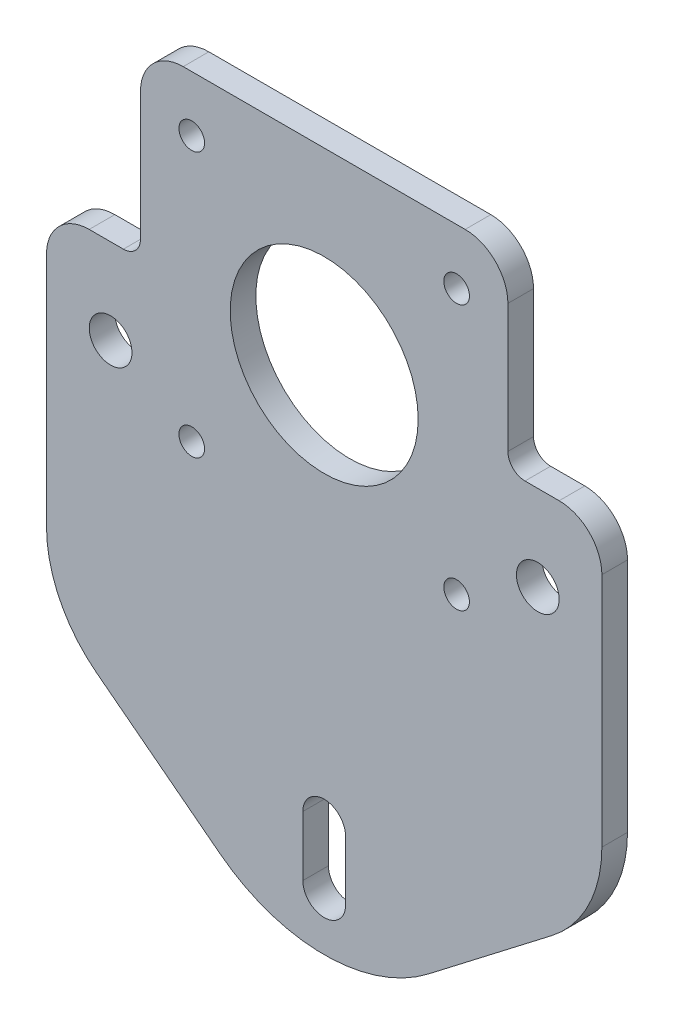
from build123d import *
from OCP.BRepFilletAPI import BRepFilletAPI_MakeFillet

# Parameters (mm, degrees)
SKETCH1_R           = 2.5
BOSS_EXTRUDE1_DEPTH = 3
BOSS_EXTRUDE3_DEPTH = 3
FILLET1_R1          = 5
FILLET1_R2          = 15
FILLET1_R3          = 20
FILLET1_R4          = 2
SKETCH3_6_R         = 1.5
CUT_EXTRUDE2_DEPTH  = 62.394217969


with BuildPart() as part:
    # Sketch1 → Boss-Extrude1 (new body)
    with BuildSketch(Plane.XY):
        Polygon((-32.5, 30), (32.5, 30), (32.5, -10), (0, -35), (-32.5, -10), align=None)
        with Locations((25, 20)):
            Circle(SKETCH1_R, mode=Mode.SUBTRACT)
        with Locations((-25, 20)):
            Circle(SKETCH1_R, mode=Mode.SUBTRACT)
        with BuildLine():
            Line((2.5, -16.5), (2.5, -23.5))
            ThreePointArc((2.5, -23.5), (0, -26), (-2.5, -23.5))
            Line((-2.5, -23.5), (-2.5, -16.5))
            ThreePointArc((-2.5, -16.5), (0, -14), (2.5, -16.5))
        make_face(mode=Mode.SUBTRACT)
    extrude(amount=BOSS_EXTRUDE1_DEPTH)

    # Sketch3 → Boss-Extrude3 (add)
    with BuildSketch(Plane.XY.offset(3)):
        with BuildLine():
            ThreePointArc((-15.5, 44), (-16.560660172, 46.560660172), (-14, 45.5))
            Line((-14, 45.5), (14, 45.5))
            ThreePointArc((14, 45.5), (15.5, 47), (17, 45.5))
            ThreePointArc((17, 45.5), (16.560660172, 44.439339828), (15.5, 44))
            Line((15.5, 44), (15.5, 30))
            Line((15.5, 30), (21.5, 30))
            Line((21.5, 30), (21.5, 52))
            Line((21.5, 52), (-21.5, 52))
            Line((-21.5, 52), (-21.5, 30))
            Line((-21.5, 30), (-15.5, 30))
            Line((-15.5, 30), (-15.5, 44))
        make_face()
        with BuildLine():
            Line((14, 45.5), (-14, 45.5))
            ThreePointArc((-14, 45.5), (-14.439339828, 44.439339828), (-15.5, 44))
            Line((-15.5, 44), (-15.5, 30))
            Line((-15.5, 30), (-11, 30))
            ThreePointArc((-11, 30), (0, 41), (11, 30))
            Line((11, 30), (15.5, 30))
            Line((15.5, 30), (15.5, 44))
            ThreePointArc((15.5, 44), (14.439339828, 44.439339828), (14, 45.5))
        make_face()
    extrude(amount=-BOSS_EXTRUDE3_DEPTH)

    # Fillet1: one fillet with a radius per group of edges: ONE call of the kernel's fillet builder (fillet() takes one radius for all edges)
    fillet1_edges_1 = [part.edges().sort_by_distance(p)[0] for p in [
        (32.5, 30, 1.5),
        (-32.5, 30, 1.5),
        (-21.5, 52, 1.5),
        (21.5, 52, 1.5),
    ]]
    fillet1_edges_2 = [part.edges().sort_by_distance(p)[0] for p in [
        (-32.5, -10, 1.5),
        (32.5, -10, 1.5),
    ]]
    fillet1_edges_3 = [part.edges().sort_by_distance(p)[0] for p in [
        (0, -35, 1.5),
    ]]
    fillet1_edges_4 = [part.edges().sort_by_distance(p)[0] for p in [
        (21.5, 30, 1.5),
        (-21.5, 30, 1.5),
    ]]
    fillet1 = BRepFilletAPI_MakeFillet(part.part.solid().wrapped)
    for e in fillet1_edges_1:
        fillet1.Add(FILLET1_R1, e.wrapped)
    for e in fillet1_edges_2:
        fillet1.Add(FILLET1_R2, e.wrapped)
    for e in fillet1_edges_3:
        fillet1.Add(FILLET1_R3, e.wrapped)
    for e in fillet1_edges_4:
        fillet1.Add(FILLET1_R4, e.wrapped)
    add(Compound.cast(fillet1.Shape()), mode=Mode.REPLACE)

    # Sketch3<6> → Cut-Extrude2 (cut, through all)
    with BuildSketch(Plane.XY.offset(3)):
        with Locations((15.5, 14.5)):
            Circle(SKETCH3_6_R)
        with Locations((-15.5, 14.5)):
            Circle(SKETCH3_6_R)
        with BuildLine():
            ThreePointArc((-11, 30), (0, 19), (11, 30))
            Line((11, 30), (-11, 30))
        make_face()
        with BuildLine():
            Line((-11, 30), (11, 30))
            ThreePointArc((11, 30), (0, 41), (-11, 30))
        make_face()
    extrude(amount=-CUT_EXTRUDE2_DEPTH, mode=Mode.SUBTRACT)


solid = part.part
